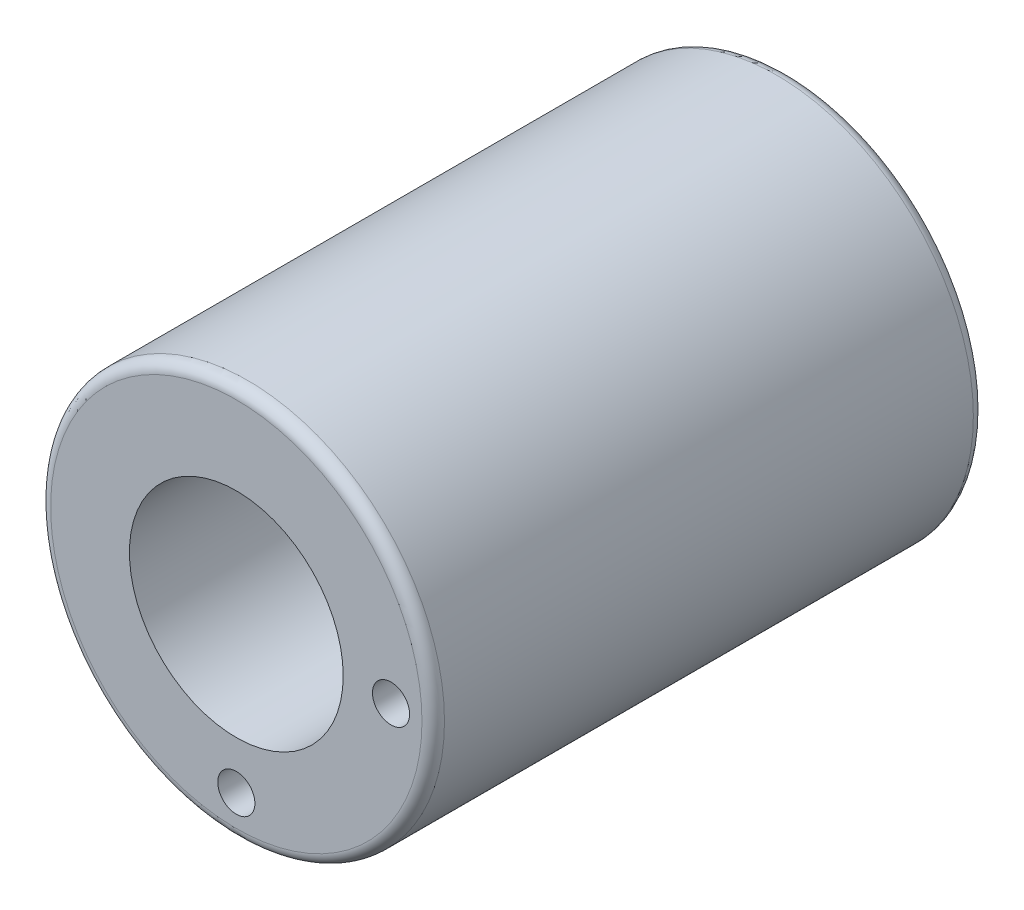
from build123d import *

# Parameters (mm, degrees)
ESBO_O1_R                 = 17.5
ESBO_O1_R_2               = 9.5
RESSALTO_EXTRUS_O1_DEPTH  = 24.5
FILETE1_R                 = 1
ESBO_O2_R                 = 6.5
CORTE_EXTRUS_O1_DEPTH     = 35.824560299
FURO_ROSCADO_DE_M41_D     = 3.3
FURO_ROSCADO_DE_M41_DEPTH = 10
FURO_ROSCADO_DE_M41_TIP   = 0.991420021


with BuildPart() as part:
    # Esboço1 → Ressalto-extrusão1 (new, symmetric)
    with BuildSketch(Plane.XY):
        Circle(ESBO_O1_R)
        Circle(ESBO_O1_R_2, mode=Mode.SUBTRACT)
    extrude(amount=RESSALTO_EXTRUS_O1_DEPTH, both=True)

    # Filete1
    filete1_edges = [part.edges().sort_by_distance(p)[0] for p in [
        (-17.5, 0, -24.5),
        (-17.5, 0, 24.5),
    ]]
    fillet(filete1_edges, radius=FILETE1_R)

    # Esboço2 → Corte-extrusão1 (cut, through all)
    with BuildSketch(Plane(origin=(0, 0, 0), x_dir=(0, 0, -1), z_dir=(1, 0, 0))):
        Circle(ESBO_O2_R)
    extrude(amount=-CORTE_EXTRUS_O1_DEPTH, mode=Mode.SUBTRACT)

    # Furo roscado de M41
    with Locations(Plane.XY.offset(24.5)):
        with Locations((13.75, 0), (0, -13.75)):
            Hole(FURO_ROSCADO_DE_M41_D / 2, depth=FURO_ROSCADO_DE_M41_DEPTH)
            with Locations((0, 0, -(FURO_ROSCADO_DE_M41_DEPTH + FURO_ROSCADO_DE_M41_TIP / 2))):  # 118° drill point
                Cone(0, FURO_ROSCADO_DE_M41_D / 2, FURO_ROSCADO_DE_M41_TIP, mode=Mode.SUBTRACT)


solid = part.part
